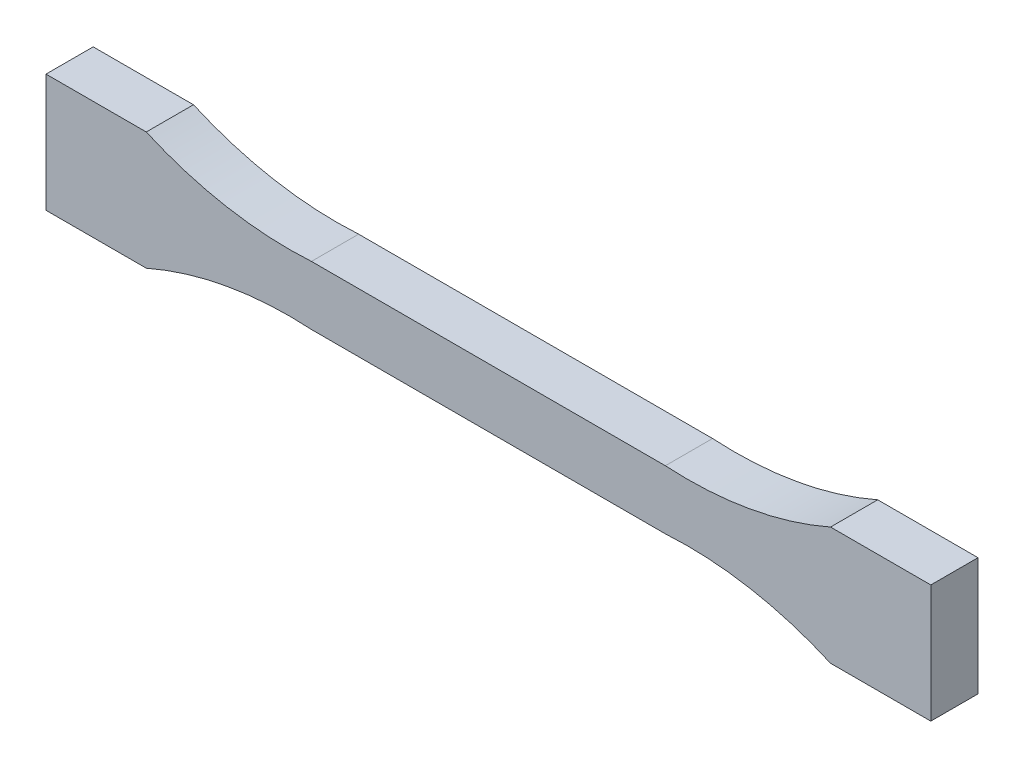
from build123d import *

# Parameters (mm, degrees)
BOSS_EXTRUDE1_DEPTH = 4


with BuildPart() as part:
    # Sketch1 → Boss-Extrude1 (new body)
    with BuildSketch(Plane.XY):
        with BuildLine():
            Line((-15, 0), (15, 0))
            ThreePointArc((15, 0), (22.150281469, -0.408423775), (29, -2.5))
            Line((29, -2.5), (37.5, -2.5))
            Line((37.5, -2.5), (37.5, 7.5))
            Line((37.5, 7.5), (29, 7.5))
            ThreePointArc((29, 7.5), (22.150281469, 5.408423775), (15, 5))
            Line((15, 5), (-15, 5))
            ThreePointArc((-15, 5), (-22.150281469, 5.408423775), (-29, 7.5))
            Line((-29, 7.5), (-37.5, 7.5))
            Line((-37.5, 7.5), (-37.5, -2.5))
            Line((-37.5, -2.5), (-29, -2.5))
            ThreePointArc((-29, -2.5), (-22.150281469, -0.408423775), (-15, 0))
        make_face()
    extrude(amount=BOSS_EXTRUDE1_DEPTH)


solid = part.part
